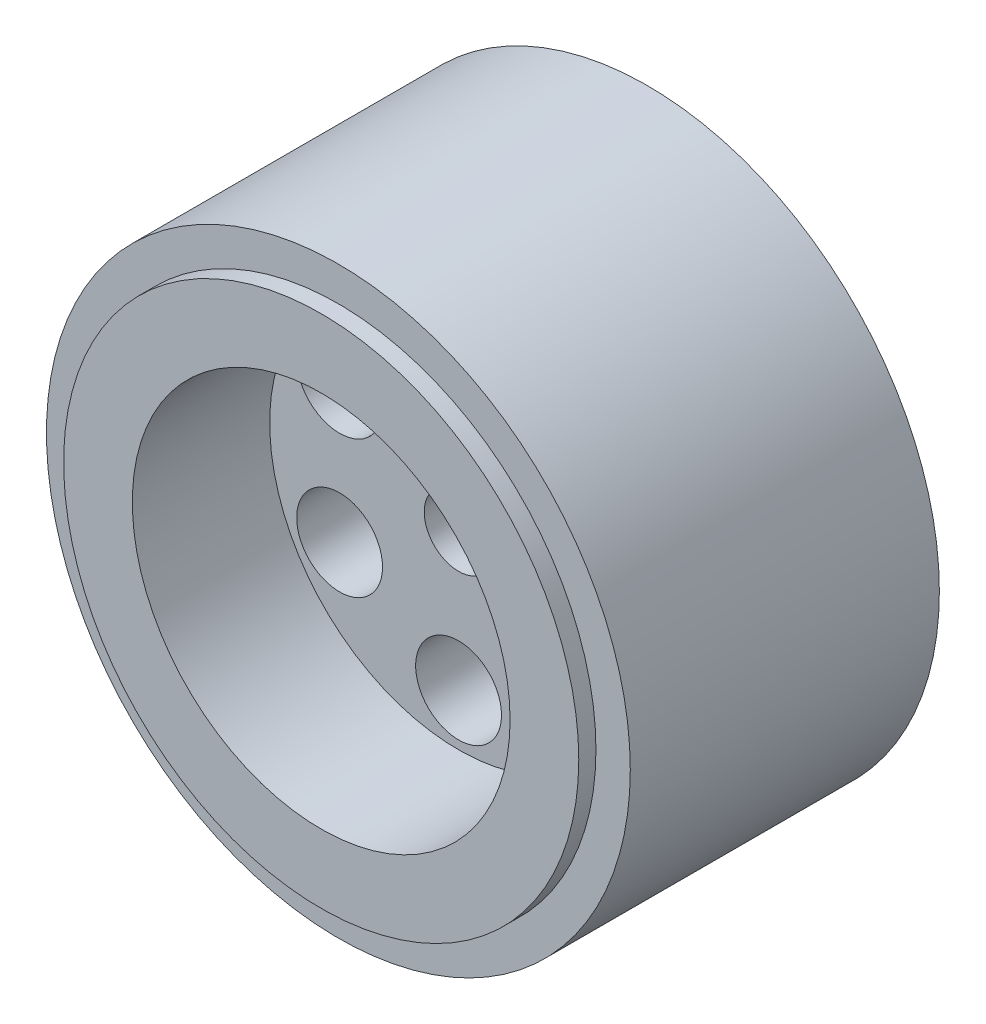
from build123d import *

# Parameters (mm, degrees)
SKETCH2_R          = 5
CUT_EXTRUDE1_DEPTH = 8
SKETCH3_W          = 35.998
SKETCH3_H          = 6


with BuildPart() as part:
    # Sketch1 → Revolve1 (revolve)
    with BuildSketch(Plane(origin=(0, 0, 0), x_dir=(0, 0, -1), z_dir=(1, 0, 0)), mode=Mode.PRIVATE) as revolve1_sk:
        Polygon((0, 4), (0, 22), (-14, 22), (-16, 22), (-16, 30), (-14, 30), (-14, 28), (22, 28), (22, 22), (8, 22), (8, 10), (22, 10), (22, 4), align=None)
    revolve(revolve1_sk.sketch.rotate(Axis((0, 0, 0), (0, 0, -1)), 90), axis=Axis((0, 0, 0), (0, 0, -1)))

    # Sketch2 → Cut-Extrude1 (cut)
    with BuildSketch(Plane.XY):
        with Locations((0, 16)):
            Circle(SKETCH2_R)
        with Locations((13.856406461, 8)):
            Circle(SKETCH2_R)
        with Locations((13.856406461, -8)):
            Circle(SKETCH2_R)
        with Locations((0, -16)):
            Circle(SKETCH2_R)
        with Locations((-13.856406461, -8)):
            Circle(SKETCH2_R)
        with Locations((-13.856406461, 8)):
            Circle(SKETCH2_R)
    extrude(amount=-CUT_EXTRUDE1_DEPTH, mode=Mode.SUBTRACT)


with BuildPart() as body_2:
    # Sketch3 → Revolve2 (revolve)
    with BuildSketch(Plane(origin=(0, 0, 0), x_dir=(0, 0, -1), z_dir=(1, 0, 0)), mode=Mode.PRIVATE) as revolve2_sk:
        with Locations((4, 31.001)):
            Rectangle(SKETCH3_W, SKETCH3_H)
    revolve(revolve2_sk.sketch.rotate(Axis((0, 0, 0), (0, 0, -1)), 90), axis=Axis((0, 0, 0), (0, 0, -1)))


solid = Compound([part.part, body_2.part])
